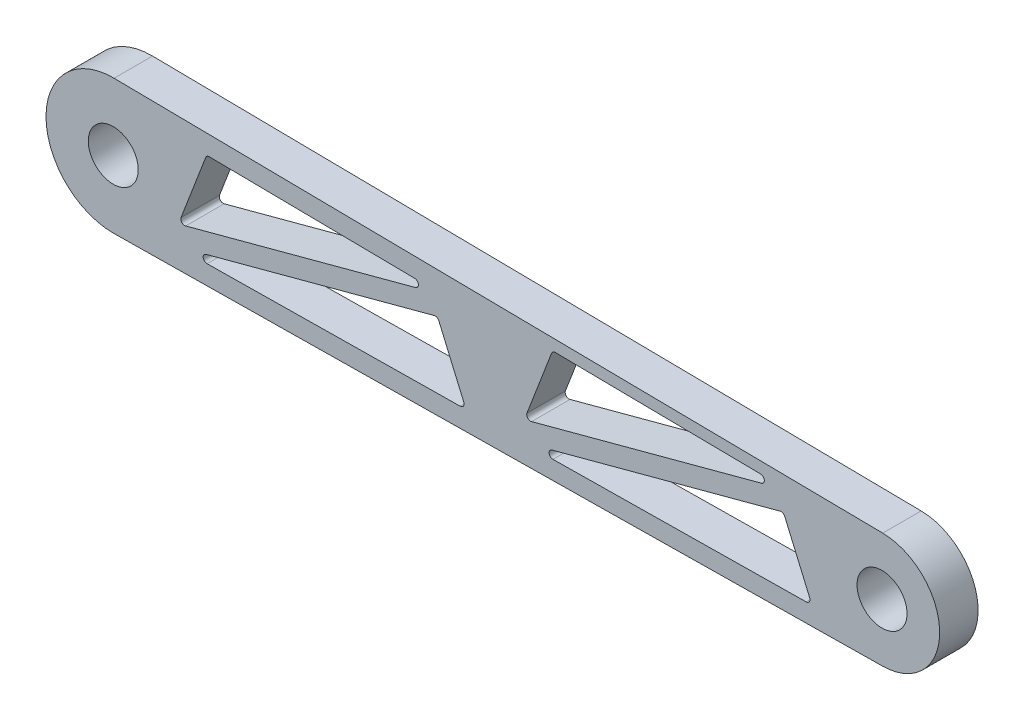
from build123d import *

# Parameters (mm, degrees)
EXTRUDE_1_DEPTH     = 10
SKETCH_2_R          = 6.5
CUT_EXTRUDE_1_DEPTH = 10
CUT_EXTRUDE_2_DEPTH = 10
FILLET_1_R          = 1
SKETCH_4_R          = 6.5
CUT_EXTRUDE_3_DEPTH = 10


with BuildPart() as part:
    # 草图1 → 凸台-拉伸1 (new body)
    with BuildSketch(Plane.XY):
        with BuildLine():
            Line((200.1875, 14.998828079), (0.21875, 17.498632759))
            ThreePointArc((0.21875, 17.498632759), (-17.5, 0), (0.21875, -17.498632759))
            Line((0.21875, -17.498632759), (200.1875, -14.998828079))
            ThreePointArc((200.1875, -14.998828079), (215, 0), (200.1875, 14.998828079))
        make_face()
    extrude(amount=EXTRUDE_1_DEPTH)

    # 草图2 → 切除-拉伸1 (cut)
    with BuildSketch(Plane.XY.offset(10)):
        Circle(SKETCH_2_R)
    extrude(amount=-CUT_EXTRUDE_1_DEPTH, mode=Mode.SUBTRACT)

    # 草图3 → 切除-拉伸2 (cut)
    with BuildSketch(Plane.XY.offset(10)):
        Polygon((24.289001935, 12.19734043), (85.658139631, 11.430166271), (16.937408094, -6.979422532), align=None)
        Polygon((16.414613885, -12.295777972), (84.346077325, 5.902373893), (91.781134838, -11.353622851), align=None)
        Polygon((106.93275646, -6.06439659), (114.284350301, 13.112366373), (175.653487997, 12.345192214), align=None)
        Polygon((181.776483204, -10.438596909), (106.409962251, -11.380752029), (174.341425691, 6.817399835), align=None)
    extrude(amount=-CUT_EXTRUDE_2_DEPTH, mode=Mode.SUBTRACT)

    # 圆角1
    fillet_1_edges = [part.edges().sort_by_distance(p)[0] for p in [
        (84.346077325, 5.902373893, 5),
        (91.781134838, -11.353622851, 5),
        (16.414613885, -12.295777972, 5),
        (175.653487997, 12.345192214, 5),
        (106.93275646, -6.06439659, 5),
        (114.284350301, 13.112366373, 5),
        (174.341425691, 6.817399835, 5),
        (181.776483204, -10.438596909, 5),
        (106.409962251, -11.380752029, 5),
        (85.658139631, 11.430166271, 5),
        (16.937408094, -6.979422532, 5),
        (24.289001935, 12.19734043, 5),
    ]]
    fillet(fillet_1_edges, radius=FILLET_1_R)

    # 草图4 → 切除-拉伸3 (cut)
    with BuildSketch(Plane.XY.offset(10)):
        with Locations((200, 0)):
            Circle(SKETCH_4_R)
    extrude(amount=-CUT_EXTRUDE_3_DEPTH, mode=Mode.SUBTRACT)


solid = part.part
